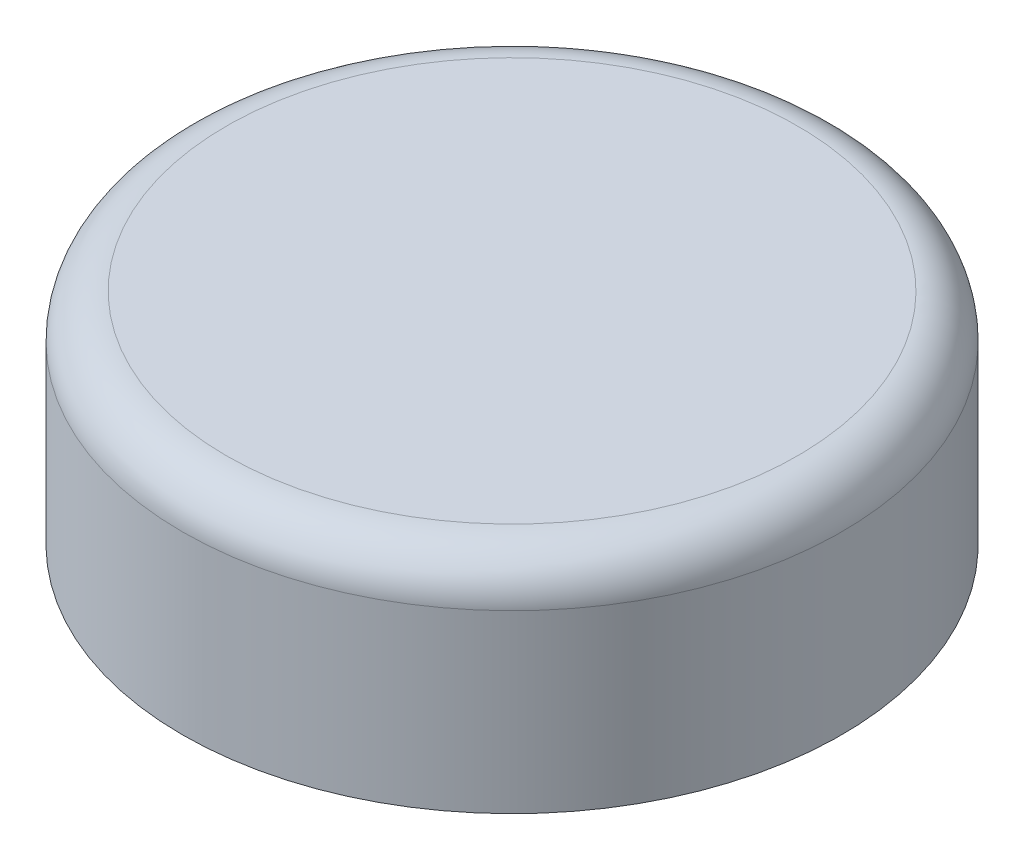
from build123d import *

# Parameters (mm, degrees)
CUT_EXTRUDE2_DEPTH = 7.5


with BuildPart() as part:
    # Sketch2 → Revolve1 (revolve)
    with BuildSketch(Plane(origin=(0, 0, 0), x_dir=(0, 0, -1), z_dir=(1, 0, 0))):
        with BuildLine():
            ThreePointArc((-15, 8), (-14.414213562, 9.414213562), (-13, 10))
            Line((-13, 10), (0, 10))
            Line((0, 10), (0, 0))
            Line((0, 0), (-15, 0))
            Line((-15, 0), (-15, 8))
        make_face()
    revolve(axis=Axis((0, 10, 0), (0, -1, 0)))

    # Sketch1 → Cut-Extrude2 (cut)
    with BuildSketch(Plane(origin=(0, 0, 0), x_dir=(1, 0, 0), z_dir=(0, 1, 0))):
        with BuildLine():
            Line((1.55, 2.684678752), (1.55, -2.684678752))
            ThreePointArc((1.55, -2.684678752), (-3.1, 0), (1.55, 2.684678752))
        make_face()
    extrude(amount=CUT_EXTRUDE2_DEPTH, mode=Mode.SUBTRACT)


solid = part.part
